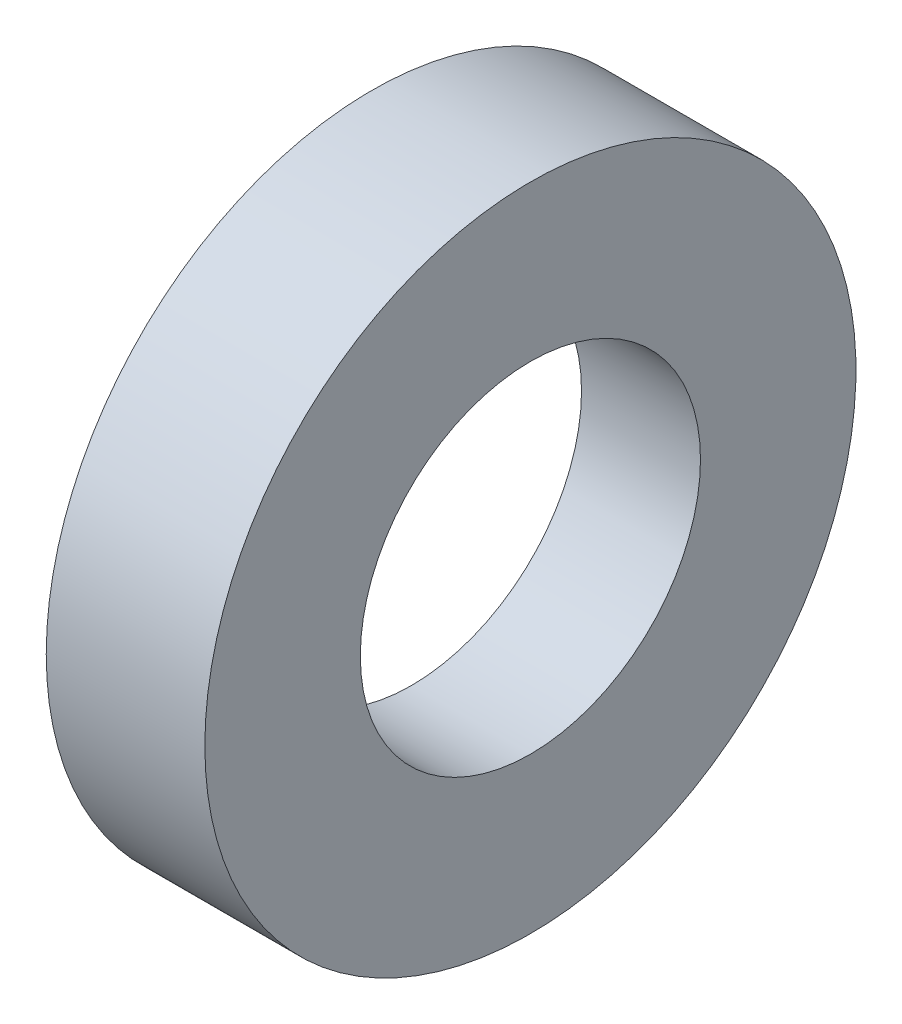
from build123d import *


with BuildPart() as part:
    # Sketch1 → Revolve1 (revolve)
    with BuildSketch(Plane.XY, mode=Mode.PRIVATE) as revolve1_sk:
        Polygon((-5.678367347, 16.3), (5.721632653, 16.3), (5.721632653, 31.2), (-9.478367347, 31.2), (-9.478367347, 22.3), (-5.678367347, 22.3), align=None)
    revolve(revolve1_sk.sketch.rotate(Axis((0, 0, 0), (1, 0, 0)), 90), axis=Axis((0, 0, 0), (1, 0, 0)))


solid = part.part
